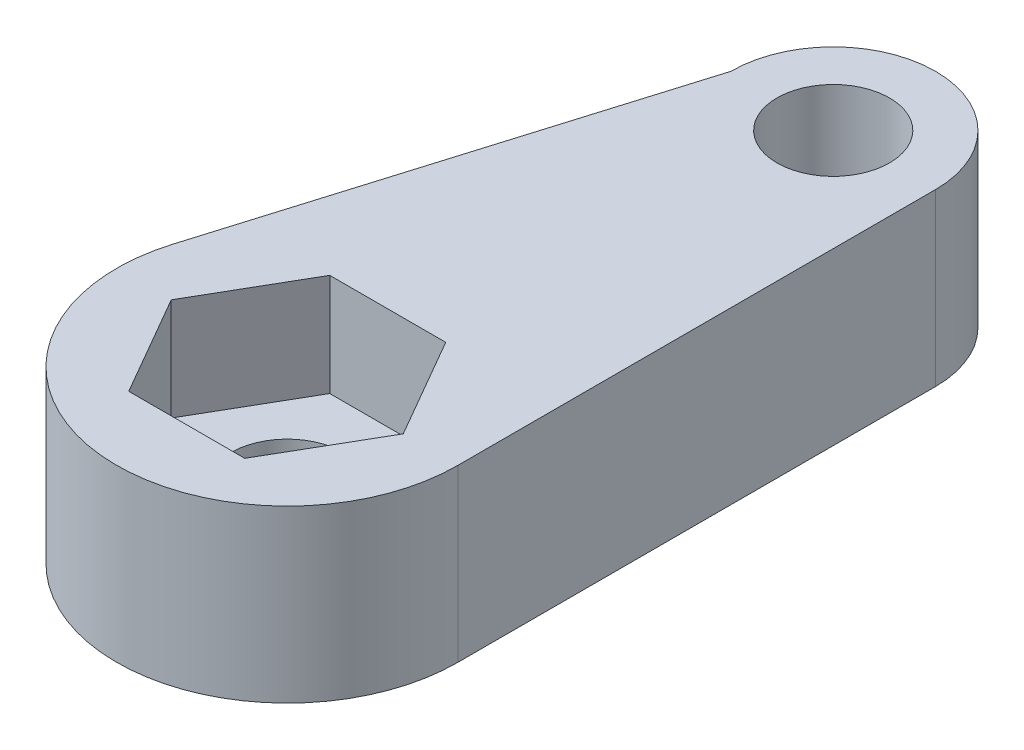
from build123d import *

# Parameters (mm, degrees)
SKETCH1_R           = 1.65
BOSS_EXTRUDE1_DEPTH = 5
CUT_EXTRUDE1_DEPTH  = 3


with BuildPart() as part:
    # Sketch1 → Boss-Extrude1 (new body)
    with BuildSketch(Plane(origin=(0, 0, 0), x_dir=(1, 0, 0), z_dir=(0, 1, 0))):
        with BuildLine():
            Line((-1.123874335, 7.64724342), (-4.910860932, -4.908083254))
            ThreePointArc((-4.910860932, -4.908083254), (-0.85362327, -11.298412816), (4.876125665, -6.35195282))
            Line((4.876125665, -6.35195282), (4.876125665, 7.64724342))
            ThreePointArc((4.876125665, 7.64724342), (1.876125665, 10.64724342), (-1.123874335, 7.64724342))
        make_face()
        with Locations(Location((1.876125665, 7.64724342, 0), (0, 0, 270))):
            Circle(SKETCH1_R, mode=Mode.SUBTRACT)
        with Locations(Location((-0.123874335, -6.35195282, 0), (0, 0, 270))):
            Circle(SKETCH1_R, mode=Mode.SUBTRACT)
    extrude(amount=BOSS_EXTRUDE1_DEPTH)

    # Sketch2 → Cut-Extrude1 (cut)
    with BuildSketch(Plane(origin=(0, 5, 0), x_dir=(1, 0, 0), z_dir=(0, 1, 0))):
        Polygon((3.276125665, -6.352756866), (1.576821989, -3.40786847), (-1.823178011, -3.407064424), (-3.523874335, -6.351148774), (-1.82457066, -9.29603717), (1.57542934, -9.296841216), align=None)
    extrude(amount=-CUT_EXTRUDE1_DEPTH, mode=Mode.SUBTRACT)


solid = part.part
